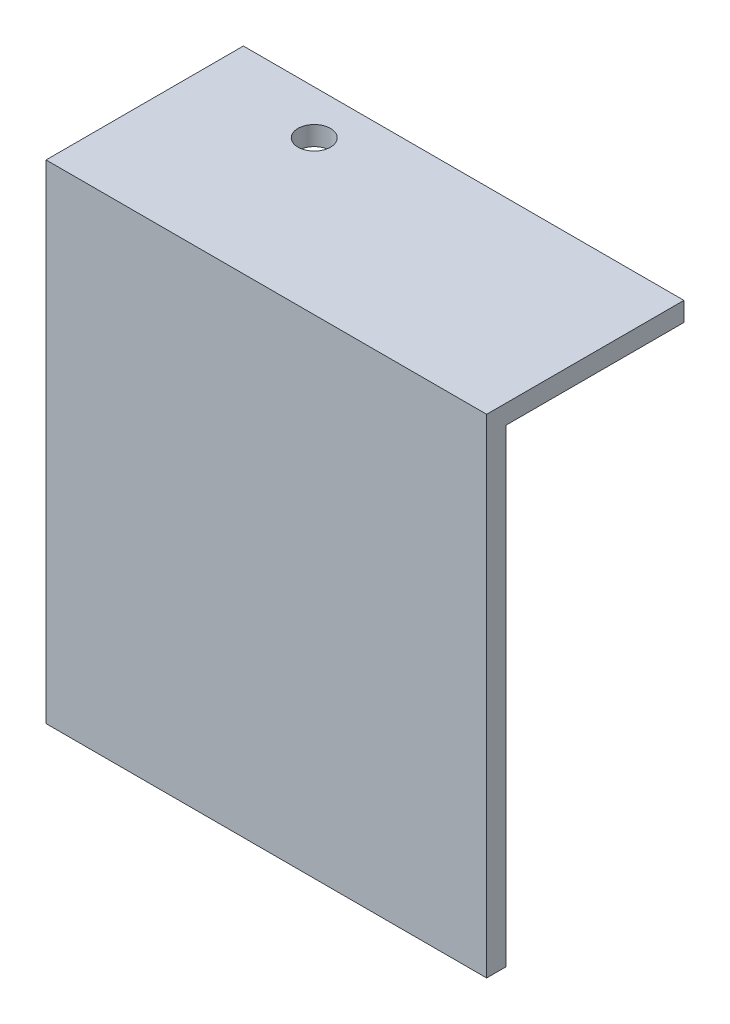
from build123d import *

# Parameters (mm, degrees)
SKETCH1_W           = 115
SKETCH1_H           = 127.43
BOSS_EXTRUDE1_DEPTH = 5
SKETCH2_W           = 115
SKETCH2_H           = 5
BOSS_EXTRUDE2_DEPTH = 46.5
SKETCH4_R           = 4.25
CUT_EXTRUDE2_DEPTH  = 178.83603375


with BuildPart() as part:
    # Sketch1 → Boss-Extrude1 (new body)
    with BuildSketch(Plane.XY):
        with Locations((57.5, 63.715)):
            Rectangle(SKETCH1_W, SKETCH1_H)
    extrude(amount=BOSS_EXTRUDE1_DEPTH)

    # Sketch2 → Boss-Extrude2 (add)
    with BuildSketch(Plane(origin=(0, 0, 0), x_dir=(-1, 0, 0), z_dir=(0, 0, -1))):
        with Locations((-57.5, 124.93)):
            Rectangle(SKETCH2_W, SKETCH2_H)
    extrude(amount=BOSS_EXTRUDE2_DEPTH)

    # Sketch4 → Cut-Extrude2 (cut, through all)
    with BuildSketch(Plane(origin=(0, 127.43, 0), x_dir=(1, 0, 0), z_dir=(0, 1, 0))):
        with Locations(Location((30, 35, 0), (0, 0, 270))):
            Circle(SKETCH4_R)
    extrude(amount=-CUT_EXTRUDE2_DEPTH, mode=Mode.SUBTRACT)


solid = part.part
